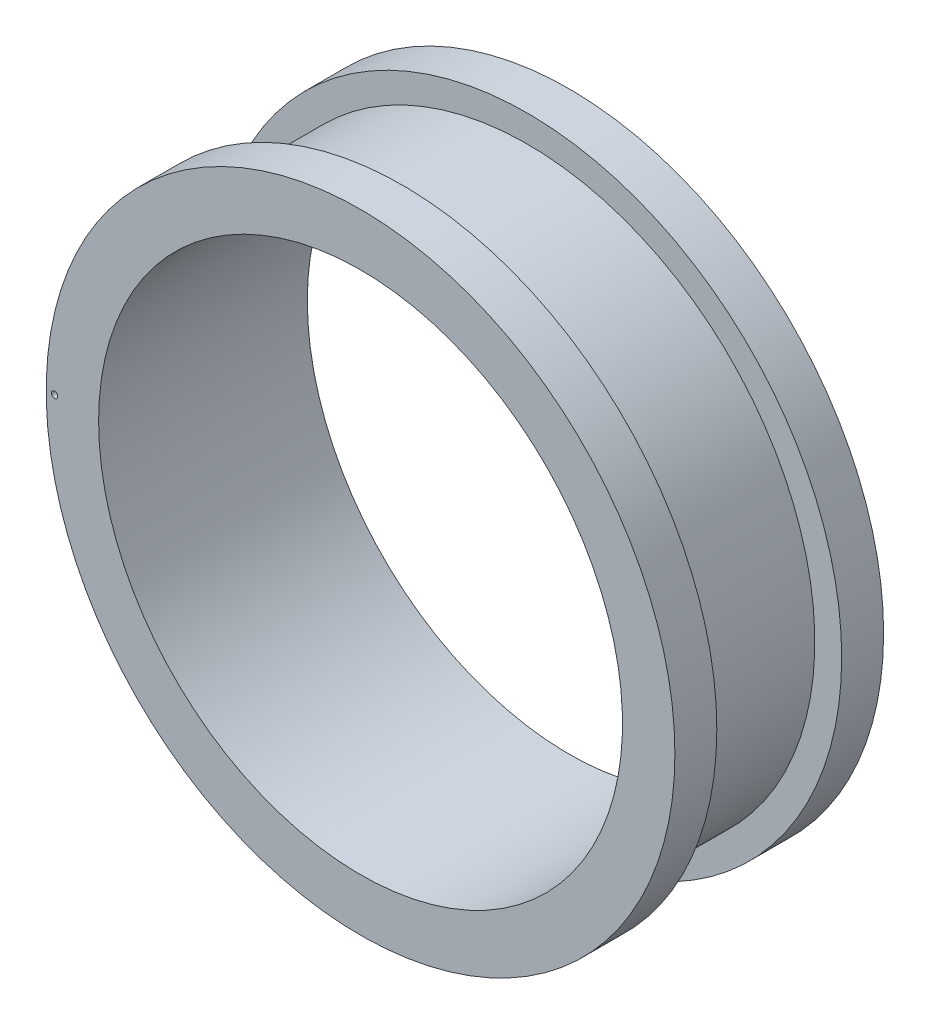
from build123d import *

# Parameters (mm, degrees)
SKETCH1_R           = 150
BOSS_EXTRUDE2_DEPTH = 20
CUT_EXTRUDE1_REACH  = 215.073
SKETCH2_R           = 125
SKETCH3_R           = 137.171463505
BOSS_EXTRUDE3_DEPTH = 59.588855351
BOSS_EXTRUDE4_START = 20
SKETCH4_R           = 150
BOSS_EXTRUDE4_DEPTH = 20
SKETCH6_R           = 125
CUT_EXTRUDE2_DEPTH  = 227.570929062
CUT_EXTRUDE5_REACH  = 236.346
SKETCH7_R           = 1.5


with BuildPart() as part:
    # Sketch1 → Boss-Extrude2 (new body)
    with BuildSketch(Plane.XY):
        Circle(SKETCH1_R)
    extrude(amount=-BOSS_EXTRUDE2_DEPTH)

    # Sketch2 → Cut-Extrude1 (cut, up to next)
    with BuildSketch(Plane(origin=(0, 0, -20), x_dir=(-1, 0, 0), z_dir=(0, 0, -1)), mode=Mode.PRIVATE) as cut_extrude1_sk1:
        Circle(SKETCH2_R)
    cut_extrude1_tool1 = extrude(cut_extrude1_sk1.sketch, amount=-CUT_EXTRUDE1_REACH, mode=Mode.PRIVATE) & part.part
    add(cut_extrude1_tool1.solids().sort_by_distance((0, 0, -20))[0], mode=Mode.SUBTRACT)

    # Sketch3 → Boss-Extrude3 (add)
    with BuildSketch(Plane.XY):
        with Locations(Location((0, 0, 0), (0, 0, 180))):
            Circle(SKETCH3_R)
    extrude(amount=BOSS_EXTRUDE3_DEPTH)

    # Sketch4 → Boss-Extrude4 (add)
    with BuildSketch(Plane.XY.offset(59.588855351).offset(BOSS_EXTRUDE4_START)):
        Circle(SKETCH4_R)
    extrude(amount=-BOSS_EXTRUDE4_DEPTH)

    # Sketch6 → Cut-Extrude2 (cut, through all)
    with BuildSketch(Plane(origin=(0, 0, 0), x_dir=(-1, 0, 0), z_dir=(0, 0, -1))):
        Circle(SKETCH6_R)
    extrude(amount=-CUT_EXTRUDE2_DEPTH, mode=Mode.SUBTRACT)

    # Sketch7 → Cut-Extrude5 (cut, up to next)
    with BuildSketch(Plane.XY.offset(79.588855351), mode=Mode.PRIVATE) as cut_extrude5_sk1:
        with Locations((-145.990171569, 0.381304843)):
            Circle(SKETCH7_R)
    cut_extrude5_tool1 = extrude(cut_extrude5_sk1.sketch, amount=-CUT_EXTRUDE5_REACH, mode=Mode.PRIVATE) & part.part
    add(cut_extrude5_tool1.solids().sort_by_distance((-145.990172, 0.381305, 79.588855))[0], mode=Mode.SUBTRACT)


solid = part.part
